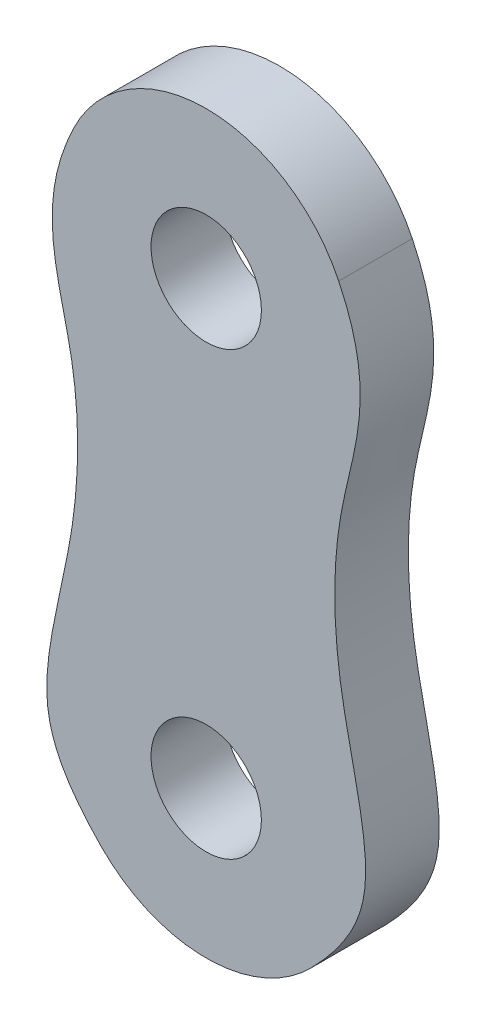
from build123d import *

# Parameters (mm, degrees)
SKETCH1_R           = 2.38125
BOSS_EXTRUDE1_DEPTH = 3.175


with BuildPart() as part:
    # Sketch1 → Boss-Extrude1 (new body)
    with BuildSketch(Plane.XY):
        with BuildLine():
            add(Edge.make_bspline(
                [(5.71857736, 21.810502305), (7.460464953, 18.202057953), (5.437393373, 14.111430659), (5.474739559, 6.883315357), (7.338602203, 0.649545133), (6.619204962, -2.309875554), (4.543798803, -4.43580798)],
                knots=[0, 0, 0, 0, 0.323130599, 0.562945369, 0.783927572, 1, 1, 1, 1], degree=3))
            ThreePointArc((5.71857736, 21.810502305), (0, 25.4), (-5.71857736, 21.810502305))
            add(Edge.make_bspline(
                [(-5.71857736, 21.810502305), (-7.460464953, 18.202057953), (-5.437393373, 14.111430659), (-5.474739559, 6.883315357), (-7.338602203, 0.649545133), (-6.619204962, -2.309875554), (-4.543798803, -4.43580798)],
                knots=[0, 0, 0, 0, 0.323130599, 0.562945369, 0.783927572, 1, 1, 1, 1], degree=3))
            ThreePointArc((-4.543798803, -4.43580798), (0, -6.35), (4.543798803, -4.43580798))
        make_face()
        with BuildLine():
            ThreePointArc((0, 2.38125), (1.683798023, 1.683798023), (2.38125, 0))
            ThreePointArc((2.38125, 0), (-1.683798023, -1.683798023), (0, 2.38125))
        make_face(mode=Mode.SUBTRACT)
        with Locations((0, 19.05)):
            Circle(SKETCH1_R, mode=Mode.SUBTRACT)
    extrude(amount=BOSS_EXTRUDE1_DEPTH)


solid = part.part
